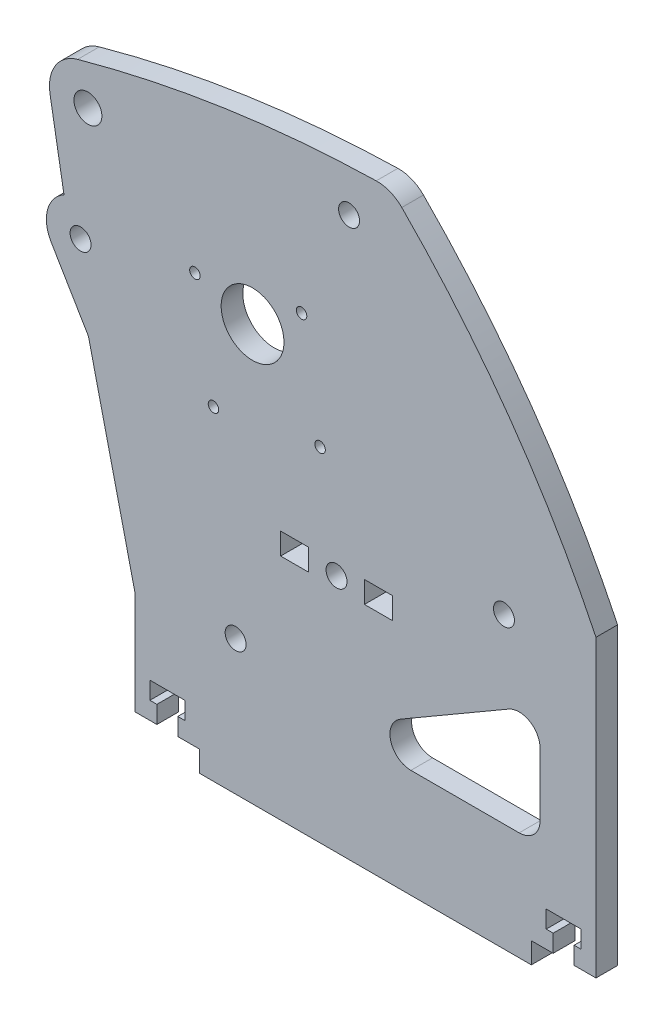
from build123d import *

# Parameters (mm, degrees)
SKETCH1_R           = 4
SKETCH1_R_2         = 3
SKETCH1_R_3         = 9
BOSS_EXTRUDE1_DEPTH = 6.2
CUT_EXTRUDE1_REACH  = 156.506
SKETCH2_R           = 1.5
CUT_EXTRUDE2_REACH  = 156.506
CUT_EXTRUDE3_REACH  = 156.506
SKETCH5_R           = 3
SKETCH5_W           = 8
SKETCH5_H           = 6.2


with BuildPart() as part:
    # Sketch1 → Boss-Extrude1 (new body)
    with BuildSketch(Plane.XY):
        with BuildLine():
            Line((-57.678304402, -8.5), (-47, -26.5))
            Line((-47, -26.5), (-33.65, -83.5))
            Line((-33.65, -83.5), (-33.65, -113))
            Line((-33.65, -113), (-15.15, -113))
            Line((-15.15, -113), (-15.15, -119))
            Line((-15.15, -119), (79.85, -119))
            Line((79.85, -119), (79.85, -113))
            Line((79.85, -113), (98.35, -113))
            Line((98.35, -113), (98.35, -28.5))
            ThreePointArc((98.35, -28.5), (73.847295802, 13.224376921), (42.748141943, 50.293889619))
            ThreePointArc((42.748141943, 50.293889619), (39.389057397, 52.524667098), (35.422008956, 53.247400666))
            ThreePointArc((35.422008956, 53.247400666), (-7.727235636, 49.583712908), (-50.093777716, 40.619560464))
            ThreePointArc((-50.093777716, 40.619560464), (-56.473591535, 35.874651698), (-58, 28.071686829))
            Line((-58, 28.071686829), (-54, 5.071686829))
            ThreePointArc((-54, 5.071686829), (-58.708572703, -0.936463864), (-57.678304402, -8.5))
        make_face()
        with Locations(Location((-47.15, 30, 0), (0, 0, 180))):
            Circle(SKETCH1_R, mode=Mode.SUBTRACT)
        with Locations(Location((27.65, 40.9, 0), (0, 0, 180))):
            Circle(SKETCH1_R_2, mode=Mode.SUBTRACT)
        with Locations(Location((-4.85, -80.4, 0), (0, 0, 180))):
            Circle(SKETCH1_R_2, mode=Mode.SUBTRACT)
        with Locations(Location((-49.25, -3.5, 0), (0, 0, 180))):
            Circle(SKETCH1_R_2, mode=Mode.SUBTRACT)
        with Locations(Location((72, -36, 0), (0, 0, 180))):
            Circle(SKETCH1_R_2, mode=Mode.SUBTRACT)
        with Locations(Location((0, 0, 0), (0, 0, 180))):
            Circle(SKETCH1_R_3, mode=Mode.SUBTRACT)
        with BuildLine():
            Line((82.35, -64), (82.35, -82))
            ThreePointArc((82.35, -82), (80.592640687, -86.242640687), (76.35, -88))
            Line((76.35, -88), (45.35, -88))
            ThreePointArc((45.35, -88), (39.556365472, -83.560063768), (42.337186896, -76.81126632))
            Line((42.337186896, -76.81126632), (73.337186896, -58.81126632))
            ThreePointArc((73.337186896, -58.81126632), (79.343586593, -58.800150068), (82.35, -64))
        make_face(mode=Mode.SUBTRACT)
    extrude(amount=BOSS_EXTRUDE1_DEPTH)

    # Sketch2 → Cut-Extrude1 (cut, up to next)
    with BuildSketch(Plane.XY.offset(6.2), mode=Mode.PRIVATE) as cut_extrude1_sk1:
        with Locations((19.348702159, -20.792251556)):
            Circle(SKETCH2_R)
    cut_extrude1_tool1 = extrude(cut_extrude1_sk1.sketch, amount=-CUT_EXTRUDE1_REACH, mode=Mode.PRIVATE) & part.part
    # Sketch2 → Cut-Extrude1 (cut, up to next)
    with BuildSketch(Plane.XY.offset(6.2), mode=Mode.PRIVATE) as cut_extrude1_sk2:
        with Locations((-11.192862241, -26.103827973)):
            Circle(SKETCH2_R)
    cut_extrude1_tool2 = extrude(cut_extrude1_sk2.sketch, amount=-CUT_EXTRUDE1_REACH, mode=Mode.PRIVATE) & part.part
    # Sketch2 → Cut-Extrude1 (cut, up to next)
    with BuildSketch(Plane.XY.offset(6.2), mode=Mode.PRIVATE) as cut_extrude1_sk3:
        with Locations((-16.504438658, 4.437736426)):
            Circle(SKETCH2_R)
    cut_extrude1_tool3 = extrude(cut_extrude1_sk3.sketch, amount=-CUT_EXTRUDE1_REACH, mode=Mode.PRIVATE) & part.part
    # Sketch2 → Cut-Extrude1 (cut, up to next)
    with BuildSketch(Plane.XY.offset(6.2), mode=Mode.PRIVATE) as cut_extrude1_sk4:
        with Locations((14.037125741, 9.749312843)):
            Circle(SKETCH2_R)
    cut_extrude1_tool4 = extrude(cut_extrude1_sk4.sketch, amount=-CUT_EXTRUDE1_REACH, mode=Mode.PRIVATE) & part.part
    add(cut_extrude1_tool1.solids().sort_by_distance((19.348702, -20.792252, 6.2))[0], mode=Mode.SUBTRACT)
    add(cut_extrude1_tool2.solids().sort_by_distance((-11.192862, -26.103828, 6.2))[0], mode=Mode.SUBTRACT)
    add(cut_extrude1_tool3.solids().sort_by_distance((-16.504439, 4.437736, 6.2))[0], mode=Mode.SUBTRACT)
    add(cut_extrude1_tool4.solids().sort_by_distance((14.037126, 9.749313, 6.2))[0], mode=Mode.SUBTRACT)

    # Sketch3 → Cut-Extrude2 (cut, up to next)
    with BuildSketch(Plane.XY.offset(6.2), mode=Mode.PRIVATE) as cut_extrude2_sk1:
        Polygon((-29.4, -103), (-19.4, -103), (-19.4, -108), (-21.4, -108), (-21.4, -113), (-27.4, -113), (-27.4, -108), (-29.4, -108), align=None)
    cut_extrude2_tool1 = extrude(cut_extrude2_sk1.sketch, amount=-CUT_EXTRUDE2_REACH, mode=Mode.PRIVATE) & part.part
    # Sketch3 → Cut-Extrude2 (cut, up to next)
    with BuildSketch(Plane.XY.offset(6.2), mode=Mode.PRIVATE) as cut_extrude2_sk2:
        Polygon((86.1, -108), (86.1, -113), (92.1, -113), (92.1, -108), (94.1, -108), (94.1, -103), (84.1, -103), (84.1, -108), align=None)
    cut_extrude2_tool2 = extrude(cut_extrude2_sk2.sketch, amount=-CUT_EXTRUDE2_REACH, mode=Mode.PRIVATE) & part.part
    add(cut_extrude2_tool1.solids().sort_by_distance((-24.4, -107.375, 6.2))[0], mode=Mode.SUBTRACT)
    add(cut_extrude2_tool2.solids().sort_by_distance((89.1, -107.375, 6.2))[0], mode=Mode.SUBTRACT)

    # Sketch5 → Cut-Extrude3 (cut, up to next)
    with BuildSketch(Plane.XY.offset(6.2), mode=Mode.PRIVATE) as cut_extrude3_sk1:
        with Locations((24.05, -50.4)):
            Circle(SKETCH5_R)
    cut_extrude3_tool1 = extrude(cut_extrude3_sk1.sketch, amount=-CUT_EXTRUDE3_REACH, mode=Mode.PRIVATE) & part.part
    # Sketch5 → Cut-Extrude3 (cut, up to next)
    with BuildSketch(Plane.XY.offset(6.2), mode=Mode.PRIVATE) as cut_extrude3_sk2:
        with Locations((36.05, -50.4)):
            Rectangle(SKETCH5_W, SKETCH5_H)
    cut_extrude3_tool2 = extrude(cut_extrude3_sk2.sketch, amount=-CUT_EXTRUDE3_REACH, mode=Mode.PRIVATE) & part.part
    # Sketch5 → Cut-Extrude3 (cut, up to next)
    with BuildSketch(Plane.XY.offset(6.2), mode=Mode.PRIVATE) as cut_extrude3_sk3:
        with Locations((12.05, -50.4)):
            Rectangle(SKETCH5_W, SKETCH5_H)
    cut_extrude3_tool3 = extrude(cut_extrude3_sk3.sketch, amount=-CUT_EXTRUDE3_REACH, mode=Mode.PRIVATE) & part.part
    add(cut_extrude3_tool1.solids().sort_by_distance((24.05, -50.4, 6.2))[0], mode=Mode.SUBTRACT)
    add(cut_extrude3_tool2.solids().sort_by_distance((36.05, -50.4, 6.2))[0], mode=Mode.SUBTRACT)
    add(cut_extrude3_tool3.solids().sort_by_distance((12.05, -50.4, 6.2))[0], mode=Mode.SUBTRACT)


solid = part.part
